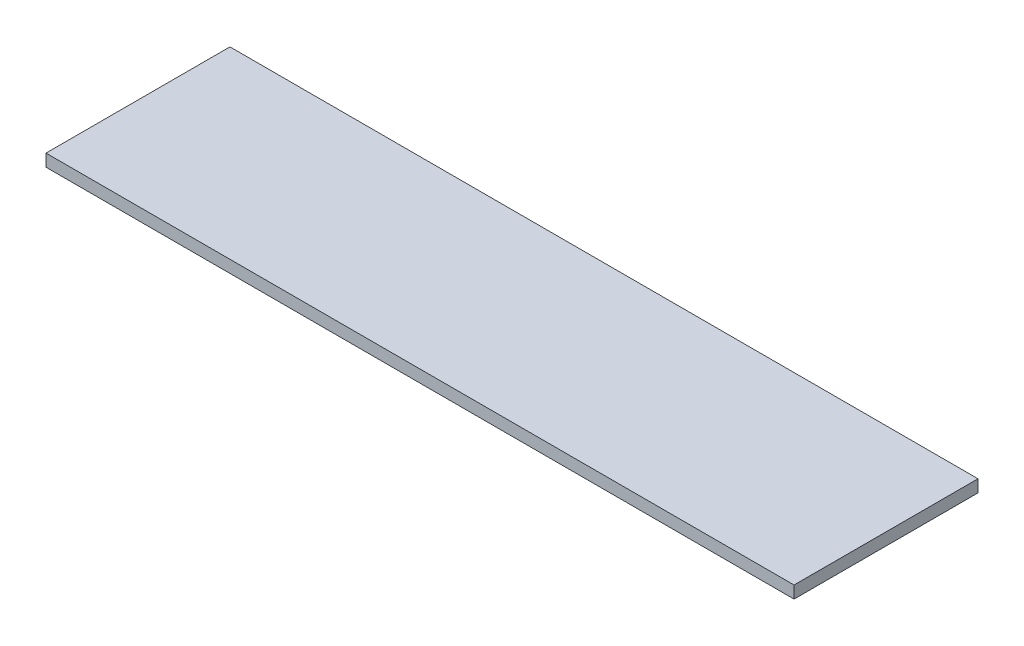
from build123d import *

# Parameters (mm, degrees)
SKETCH1_W           = 774.7
SKETCH1_H           = 190.5
BOSS_EXTRUDE1_DEPTH = 12.7


with BuildPart() as part:
    # Sketch1 → Boss-Extrude1 (new body)
    with BuildSketch(Plane(origin=(0, 0, 0), x_dir=(1, 0, 0), z_dir=(0, 1, 0))):
        with Locations((387.35, 95.25)):
            Rectangle(SKETCH1_W, SKETCH1_H)
    extrude(amount=BOSS_EXTRUDE1_DEPTH)


solid = part.part
